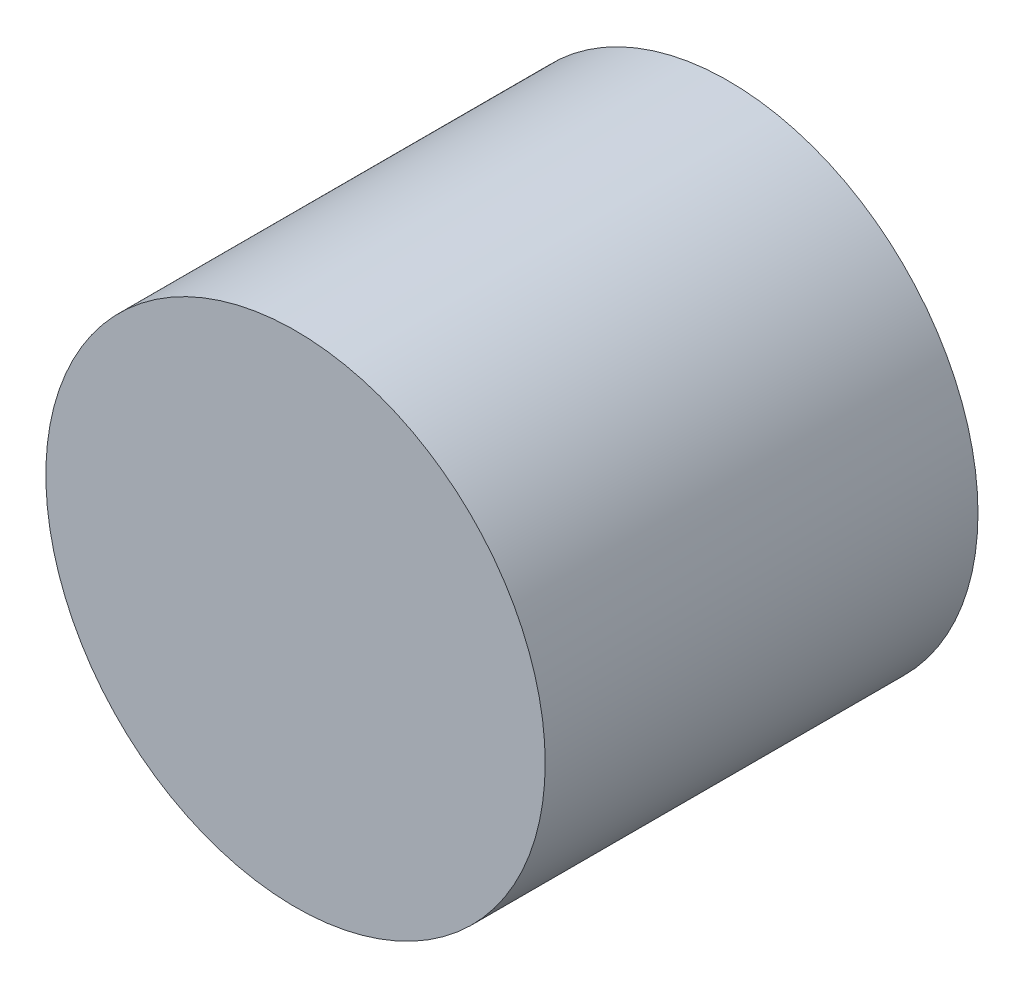
from build123d import *

# Parameters (mm, degrees)
SKETCH1_R           = 15
BOSS_EXTRUDE1_DEPTH = 26
SKETCH5_R           = 3
CUT_EXTRUDE1_DEPTH  = 23.5


with BuildPart() as part:
    # Sketch1 → Boss-Extrude1 (new body)
    with BuildSketch(Plane.XY):
        with Locations(Location((0, 0, 0), (0, 0, 180))):
            Circle(SKETCH1_R)
    extrude(amount=BOSS_EXTRUDE1_DEPTH)

    # Sketch5 → Cut-Extrude1 (cut)
    with BuildSketch(Plane(origin=(0, 0, 0), x_dir=(0, 0, -1), z_dir=(1, 0, 0))):
        with Locations((-13.142557715, 0)):
            Circle(SKETCH5_R)
    extrude(amount=-CUT_EXTRUDE1_DEPTH, mode=Mode.SUBTRACT)


solid = part.part
